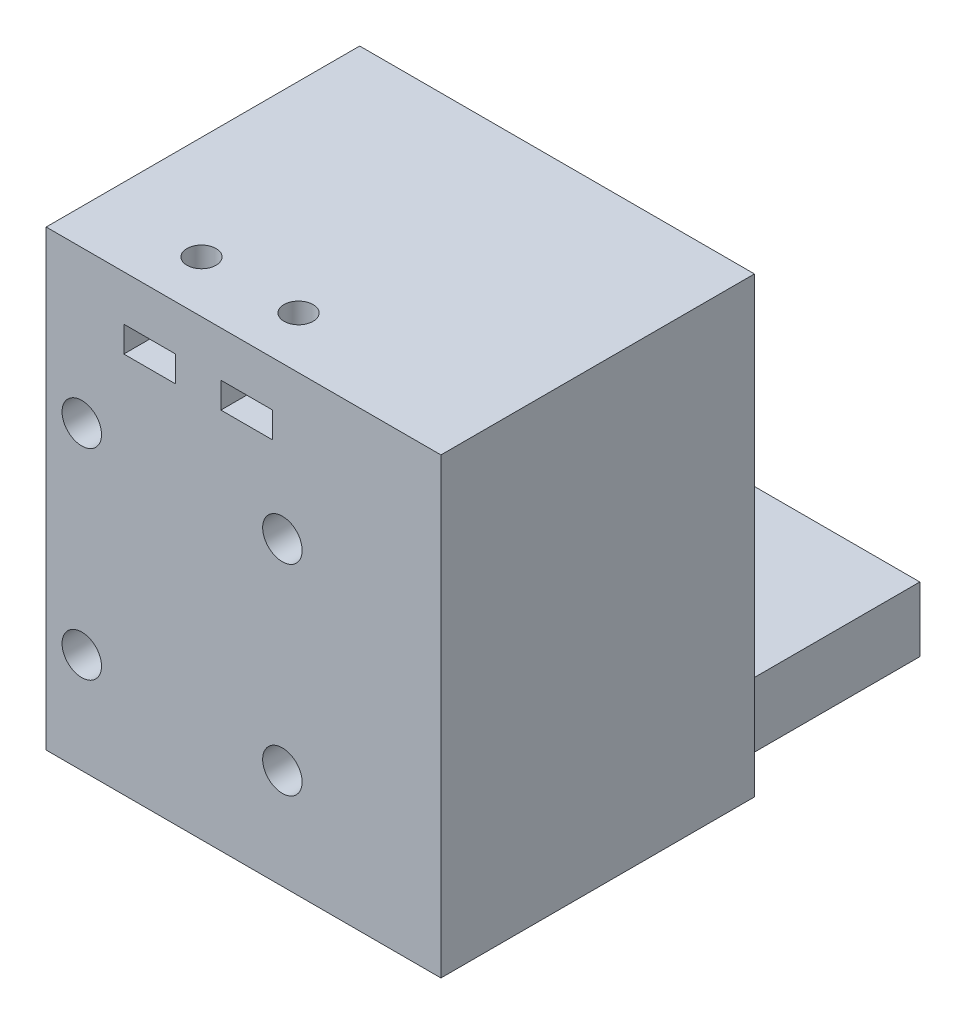
from build123d import *
from build123d.topology import SkipClean

# Parameters (mm, degrees)
SKETCH1_W           = 42
SKETCH1_H           = 42
SKETCH1_R           = 11.5
SKETCH1_R_2         = 1.7
BOSS_EXTRUDE1_DEPTH = 3
SKETCH2_W           = 55
SKETCH2_H           = 80
SKETCH2_R           = 4.05
SKETCH2_W_2         = 32
SKETCH2_H_2         = 23
BOSS_EXTRUDE2_DEPTH = 10
BOSS_EXTRUDE3_DEPTH = 23
SKETCH4_R           = 4.05
BOSS_EXTRUDE4_DEPTH = 3
SKETCH5_W           = 42
SKETCH5_H           = 22.445
BOSS_EXTRUDE5_DEPTH = 42
SKETCH6_R           = 1.7
CUT_EXTRUDE1_DEPTH  = 85.474363123
SKETCH7_R           = 3.05
CUT_EXTRUDE2_DEPTH  = 43.445
BOSS_EXTRUDE6_DEPTH = 48.445
SKETCH9_R           = 2
CUT_EXTRUDE3_DEPTH  = 5
SKETCH10_R          = 2.25
CUT_EXTRUDE4_DEPTH  = 15
SKETCH11_W          = 8
SKETCH11_H          = 4
CUT_EXTRUDE5_DEPTH  = 13
CUT_EXTRUDE6_DEPTH  = 0.5


with BuildPart() as part:
    # Sketch1 → Boss-Extrude1 (new body)
    with BuildSketch(Plane.XY):
        with Locations((21, 21)):
            Rectangle(SKETCH1_W, SKETCH1_H)
        with Locations((21, 21)):
            Circle(SKETCH1_R, mode=Mode.SUBTRACT)
        with Locations((5.5, 36.5)):
            Circle(SKETCH1_R_2, mode=Mode.SUBTRACT)
        with Locations((36.5, 36.5)):
            Circle(SKETCH1_R_2, mode=Mode.SUBTRACT)
        with Locations((5.5, 5.5)):
            Circle(SKETCH1_R_2, mode=Mode.SUBTRACT)
        with Locations((36.5, 5.5)):
            Circle(SKETCH1_R_2, mode=Mode.SUBTRACT)
    extrude(amount=BOSS_EXTRUDE1_DEPTH)

    # Sketch2 → Boss-Extrude2 (add)
    with BuildSketch(Plane(origin=(0, 0, 0), x_dir=(-1, 0, 0), z_dir=(0, -1, 0))):
        with Locations((-27.5, -8.445)):
            Rectangle(SKETCH2_W, SKETCH2_H)
        with Locations(Location((-40, 22.555, 0), (0, 0, 90))):
            Circle(SKETCH2_R, mode=Mode.SUBTRACT)
        with Locations(Location((-40, -39.445, 0), (0, 0, 90))):
            Circle(SKETCH2_R, mode=Mode.SUBTRACT)
        with Locations((-21, -14.5)):
            Rectangle(SKETCH2_W_2, SKETCH2_H_2, mode=Mode.SUBTRACT)
    extrude(amount=BOSS_EXTRUDE2_DEPTH)

    # Sketch3 → Boss-Extrude3 (add)
    with SkipClean():  # the faces are left unmerged after this step: merging them gives an invalid solid
        with BuildSketch(Plane.XY.offset(3)):
            with BuildLine():
                Line((0, 21), (9.5, 21))
                ThreePointArc((9.5, 21), (21, 32.5), (32.5, 21))
                Line((32.5, 21), (42, 21))
                Line((42, 21), (42, 42))
                Line((42, 42), (0, 42))
                Line((0, 42), (0, 21))
            make_face()
        extrude(amount=BOSS_EXTRUDE3_DEPTH)

    # Sketch4 → Boss-Extrude4 (add)
    with SkipClean():  # the faces are left unmerged after this step: merging them gives an invalid solid
        with BuildSketch(Plane(origin=(0, 0, 0), x_dir=(1, 0, 0), z_dir=(0, 1, 0))):
            with Locations(Location((40, 22.555, 0), (0, 0, 270))):
                Circle(SKETCH4_R)
            with Locations(Location((40, -39.445, 0), (0, 0, 270))):
                Circle(SKETCH4_R)
        extrude(amount=-BOSS_EXTRUDE4_DEPTH)

    # Sketch5 → Boss-Extrude5 (add)
    with SkipClean():  # the faces are left unmerged after this step: merging them gives an invalid solid
        with BuildSketch(Plane(origin=(0, 0, 0), x_dir=(1, 0, 0), z_dir=(0, 1, 0))):
            with Locations((21, -37.2225)):
                Rectangle(SKETCH5_W, SKETCH5_H)
        extrude(amount=BOSS_EXTRUDE5_DEPTH)

    # Sketch6 → Cut-Extrude1 (cut, through all)
    with SkipClean():  # the faces are left unmerged after this step: merging them gives an invalid solid
        with BuildSketch(Plane(origin=(0, 0, 0), x_dir=(-1, 0, 0), z_dir=(0, 0, -1))):
            with Locations((-5.5, 36.5)):
                Circle(SKETCH6_R)
            with Locations((-36.5, 36.5)):
                Circle(SKETCH6_R)
        extrude(amount=-CUT_EXTRUDE1_DEPTH, mode=Mode.SUBTRACT)

    # Sketch7 → Cut-Extrude2 (cut)
    with SkipClean():  # the faces are left unmerged after this step: merging them gives an invalid solid
        with BuildSketch(Plane.XY.offset(48.445)):
            with Locations((5.5, 36.5)):
                Circle(SKETCH7_R)
            with Locations((36.5, 36.5)):
                Circle(SKETCH7_R)
            with Locations((5.5, 5.5)):
                Circle(SKETCH7_R)
            with Locations((36.5, 5.5)):
                Circle(SKETCH7_R)
        extrude(amount=-CUT_EXTRUDE2_DEPTH, mode=Mode.SUBTRACT)

    # Sketch8 → Boss-Extrude6 (add)
    with SkipClean():  # the faces are left unmerged after this step: merging them gives an invalid solid
        with BuildSketch(Plane.XY.offset(48.445)):
            Polygon((55, -10), (60.999999938, -10), (60.999999938, 60), (0, 60), (0, 42), (42, 42), (42, 0), (55, 0), align=None)
        extrude(amount=-BOSS_EXTRUDE6_DEPTH)

    # Sketch9 → Cut-Extrude3 (cut)
    with SkipClean():  # the faces are left unmerged after this step: merging them gives an invalid solid
        with BuildSketch(Plane(origin=(0, 0, 0), x_dir=(-1, 0, 0), z_dir=(0, 0, -1))):
            with Locations((-48.5, 52.5)):
                Circle(SKETCH9_R)
            with Locations((-48.5, 37.5)):
                Circle(SKETCH9_R)
        extrude(amount=-CUT_EXTRUDE3_DEPTH, mode=Mode.SUBTRACT)

    # Sketch10 → Cut-Extrude4 (cut)
    with SkipClean():  # the faces are left unmerged after this step: merging them gives an invalid solid
        with BuildSketch(Plane(origin=(0, 60, 0), x_dir=(1, 0, 0), z_dir=(0, 1, 0))):
            with Locations(Location((30.999999938, -40.445, 0), (0, 0, 180))):
                Circle(SKETCH10_R)
            with Locations(Location((15.999999938, -40.445, 0), (0, 0, 180))):
                Circle(SKETCH10_R)
        extrude(amount=-CUT_EXTRUDE4_DEPTH, mode=Mode.SUBTRACT)

    # Sketch11 → Cut-Extrude5 (cut)
    with SkipClean():  # the faces are left unmerged after this step: merging them gives an invalid solid
        with BuildSketch(Plane.XY.offset(48.445)):
            with Locations((15.999999938, 51)):
                Rectangle(SKETCH11_W, SKETCH11_H)
            with Locations((30.999999938, 51)):
                Rectangle(SKETCH11_W, SKETCH11_H)
        extrude(amount=-CUT_EXTRUDE5_DEPTH, mode=Mode.SUBTRACT)

    # Sketch12 → Cut-Extrude6 (cut)
    with SkipClean():  # the faces are left unmerged after this step: merging them gives an invalid solid
        with BuildSketch(Plane.ZY):
            with BuildLine():
                Line((24.5, 43.192307692), (24.5, 41.241185897))
                add(Edge.make_bspline(
                    [(24.5, 41.241185897), (24.499497856, 41.14567596), (24.498524576, 40.96055393), (24.483429916, 40.691355525), (24.462848002, 40.439216066), (24.430190594, 40.204062431), (24.390785516, 39.986003281), (24.343066042, 39.78438146), (24.285847146, 39.599838111), (24.194857771, 39.379516007), (24.059648718, 39.128314119), (23.859852818, 38.856318711), (23.615474352, 38.62373517), (23.339809622, 38.423202835), (23.03656456, 38.263771065), (22.712966878, 38.148430215), (22.373190472, 38.075407714), (22.13992425, 38.067897902), (22.022035256, 38.064102564)],
                    knots=[0, 0, 0, 0, 1.001505555, 1.941167018, 2.826882275, 3.653841531, 4.429895133, 5.150066043, 5.825578002, 6.45369114, 7.647487171, 8.808567382, 9.977351308, 11.170798116, 12.373658725, 13.556498008, 14.765093433, 16, 16, 16, 16], degree=3))
                add(Edge.make_bspline(
                    [(22.022035256, 38.064102564), (21.911580671, 38.067165678), (21.694526995, 38.073184985), (21.37757337, 38.132703991), (21.074617509, 38.221319302), (20.789394232, 38.34996255), (20.525569276, 38.515437577), (20.284710542, 38.714567672), (20.072655039, 38.951658082), (19.954598688, 39.129577116), (19.89463141, 39.219951923)],
                    knots=[0, 0, 0, 0, 1.044266239, 2.052081639, 3.041743201, 4.026043445, 5.00270663, 5.980942822, 6.97441044, 8, 8, 8, 8], degree=3))
                add(Edge.make_bspline(
                    [(19.89463141, 39.219951923), (19.851050785, 39.106331676), (19.767670252, 38.888947997), (19.619452339, 38.589584241), (19.460060141, 38.330627947), (19.285074589, 38.111794083), (19.094100092, 37.927460417), (18.890960811, 37.761924959), (18.665655913, 37.62324336), (18.4246008, 37.504104176), (18.169487316, 37.410342887), (17.901482193, 37.344000623), (17.623582213, 37.303236531), (17.434165137, 37.29767794), (17.338541667, 37.294871795)],
                    knots=[0, 0, 0, 0, 1.272302504, 2.434229863, 3.488457646, 4.447234501, 5.35599188, 6.26022912, 7.18267843, 8.11661068, 9.06895546, 10.019249207, 11.000057067, 12, 12, 12, 12], degree=3))
                add(Edge.make_bspline(
                    [(17.338541667, 37.294871795), (17.240922586, 37.297663659), (17.048854309, 37.303156731), (16.766688875, 37.343658425), (16.497075227, 37.412301854), (16.238096372, 37.506621674), (15.991218221, 37.63042034), (15.753348832, 37.777832291), (15.530824885, 37.957251317), (15.318354516, 38.15723922), (15.127430595, 38.383747032), (14.957455291, 38.628095775), (14.817026751, 38.893799988), (14.700537846, 39.1767393), (14.610259539, 39.478793853), (14.547584152, 39.798843701), (14.505255067, 40.136958394), (14.501781412, 40.368987925), (14.5, 40.487980769)],
                    knots=[0, 0, 0, 0, 0.978404568, 1.925038397, 2.85041836, 3.763147166, 4.682162379, 5.614488577, 6.562659439, 7.54271123, 8.535210642, 9.526693784, 10.520907202, 11.541451354, 12.589717429, 13.675358278, 14.807842563, 16, 16, 16, 16], degree=3))
                Line((14.5, 40.487980769), (14.5, 43.192307692))
                Line((14.5, 43.192307692), (24.5, 43.192307692))
            make_face()
            with BuildLine():
                Line((23.474358974, 42.294871795), (20.269230769, 42.294871795))
                Line((20.269230769, 42.294871795), (20.269230769, 41.691907051))
                add(Edge.make_bspline(
                    [(20.269230769, 41.691907051), (20.270363898, 41.603766842), (20.272553333, 41.433461997), (20.2790227, 41.186178308), (20.29634395, 40.95721454), (20.31466403, 40.745781725), (20.342873204, 40.553296978), (20.377393307, 40.379115913), (20.413582311, 40.221673836), (20.475300035, 40.04019107), (20.565587551, 39.834392018), (20.709001208, 39.616396837), (20.875177169, 39.421096083), (21.070458782, 39.258022414), (21.283663042, 39.123458133), (21.514808955, 39.033655771), (21.75487266, 38.969960136), (21.920111147, 38.964374443), (22.00400641, 38.961538462)],
                    knots=[0, 0, 0, 0, 1.156481963, 2.23455883, 3.244418989, 4.168404366, 5.01828131, 5.794834307, 6.498111525, 7.13526334, 8.307595709, 9.435046769, 10.546766856, 11.659452936, 12.760769924, 13.837671619, 14.902137667, 16, 16, 16, 16], degree=3))
                add(Edge.make_bspline(
                    [(22.00400641, 38.961538462), (22.059534755, 38.962956855), (22.168459668, 38.965739189), (22.326635475, 38.991061732), (22.477303511, 39.02780499), (22.616998516, 39.085209167), (22.74969102, 39.154622683), (22.869487262, 39.24491707), (22.982950393, 39.346890049), (23.085914329, 39.466647387), (23.178170419, 39.603609212), (23.259347686, 39.759080518), (23.323382636, 39.934917714), (23.380825395, 40.127133888), (23.420684409, 40.338805291), (23.454011853, 40.567863604), (23.470953116, 40.816251999), (23.473198366, 40.988094648), (23.474358974, 41.076923077)],
                    knots=[0, 0, 0, 0, 0.911752476, 1.788502045, 2.626783689, 3.45400582, 4.26402138, 5.080402872, 5.911472738, 6.767166405, 7.66795952, 8.620018292, 9.640966946, 10.73819047, 11.913090943, 13.176185384, 14.540321519, 16, 16, 16, 16], degree=3))
                Line((23.474358974, 41.076923077), (23.474358974, 42.294871795))
            make_face(mode=Mode.SUBTRACT)
            with BuildLine():
                Line((19.243589744, 42.294871795), (15.525641026, 42.294871795))
                Line((15.525641026, 42.294871795), (15.525641026, 41.016826923))
                add(Edge.make_bspline(
                    [(15.525641026, 41.016826923), (15.526733617, 40.925343824), (15.528839444, 40.749022211), (15.535789141, 40.494453305), (15.551265082, 40.259143682), (15.576494995, 40.042957937), (15.602711072, 39.843993047), (15.638995391, 39.664225732), (15.680246274, 39.503380395), (15.74408397, 39.31689985), (15.843087679, 39.106775948), (15.993336404, 38.880493661), (16.169977604, 38.677301457), (16.376994582, 38.506731778), (16.600385956, 38.365882025), (16.838983313, 38.267095876), (17.08550776, 38.203577797), (17.254027237, 38.196071956), (17.338541667, 38.192307692)],
                    knots=[0, 0, 0, 0, 1.159821618, 2.235403267, 3.228114831, 4.14795534, 4.994323282, 5.771256229, 6.471395042, 7.097801288, 8.267864287, 9.404187171, 10.531774336, 11.667624178, 12.792825787, 13.866573821, 14.930062559, 16, 16, 16, 16], degree=3))
                add(Edge.make_bspline(
                    [(17.338541667, 38.192307692), (17.391386618, 38.193077096), (17.496224128, 38.194603493), (17.650169664, 38.218489039), (17.799957065, 38.251810934), (17.943321327, 38.300063903), (18.082595293, 38.360906985), (18.215353028, 38.437262746), (18.344768819, 38.525439183), (18.508191635, 38.663376267), (18.696546566, 38.863818811), (18.880932539, 39.148711644), (19.029642505, 39.472627884), (19.092783589, 39.707564234), (19.125400641, 39.828926282)],
                    knots=[0, 0, 0, 0, 0.723503378, 1.435336582, 2.130201219, 2.824764462, 3.504949994, 4.209866579, 4.920640069, 5.648298893, 7.13757748, 8.670694625, 10.280166878, 12, 12, 12, 12], degree=3))
                add(Edge.make_bspline(
                    [(19.125400641, 39.828926282), (19.135272973, 39.877580796), (19.156678225, 39.983073819), (19.179258903, 40.155096351), (19.199514507, 40.352143074), (19.2141042, 40.573371777), (19.229765981, 40.819662313), (19.235640104, 41.09093556), (19.242809782, 41.387383297), (19.243323106, 41.593076042), (19.243589744, 41.699919872)],
                    knots=[0, 0, 0, 0, 0.634452549, 1.375623993, 2.216454381, 3.166361212, 4.209414599, 5.370755378, 6.634280627, 8, 8, 8, 8], degree=3))
                Line((19.243589744, 41.699919872), (19.243589744, 42.294871795))
            make_face(mode=Mode.SUBTRACT)
        extrude(amount=-CUT_EXTRUDE6_DEPTH, mode=Mode.SUBTRACT)


solid = part.part
